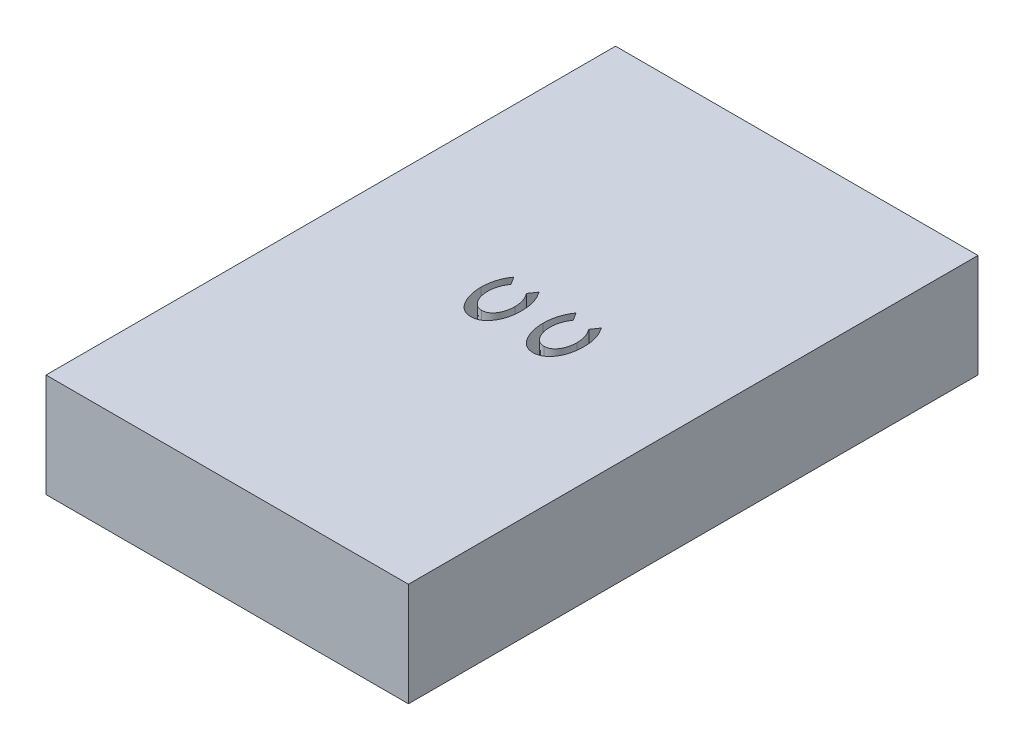
from build123d import *

# Parameters (mm, degrees)
SKETCH1_W           = 88.9
SKETCH1_H           = 139.7
BOSS_EXTRUDE1_DEPTH = 25.4
CUT_EXTRUDE1_DEPTH  = 168.52450567


with BuildPart() as part:
    # Sketch1 → Boss-Extrude1 (new body)
    with BuildSketch(Plane(origin=(0, 0, 0), x_dir=(1, 0, 0), z_dir=(0, 1, 0))):
        with Locations((44.45, 69.85)):
            Rectangle(SKETCH1_W, SKETCH1_H)
    extrude(amount=BOSS_EXTRUDE1_DEPTH)

    # Sketch2 → Cut-Extrude1 (cut, through all)
    with BuildSketch(Plane(origin=(0, 25.4, 0), x_dir=(1, 0, 0), z_dir=(0, 1, 0))):
        with BuildLine():
            Line((36.577373798, 78.153846154), (37.77563101, 76.274414062))
            add(Edge.make_bspline(
                [(37.77563101, 76.274414062), (37.664962214, 76.113861582), (37.445317785, 75.795212971), (37.162879914, 75.291703682), (36.925681736, 74.772328058), (36.730450301, 74.238357525), (36.577163714, 73.68982456), (36.468560921, 73.125780616), (36.40182813, 72.547061413), (36.394220943, 72.155741985), (36.390384615, 71.958398437)],
                knots=[0, 0, 0, 0, 1.014870556, 2.014214241, 3.001102769, 3.98480828, 4.971430097, 5.963129284, 6.972800063, 8, 8, 8, 8], degree=3))
            add(Edge.make_bspline(
                [(36.390384615, 71.958398437), (36.393377813, 71.792939644), (36.399248414, 71.468422954), (36.443557081, 70.991475949), (36.517968211, 70.534464254), (36.620523194, 70.09683415), (36.752274284, 69.678687906), (36.914168139, 69.280640221), (37.108484652, 68.903651895), (37.326823183, 68.548788057), (37.569716867, 68.227511987), (37.824226337, 67.941449173), (38.097834171, 67.702480559), (38.385102177, 67.50696409), (38.685378136, 67.350955263), (39.000978792, 67.242323381), (39.330352597, 67.174681108), (39.554883328, 67.167229511), (39.668419471, 67.163461538)],
                knots=[0, 0, 0, 0, 1.236321674, 2.424815318, 3.575766851, 4.69401689, 5.780795808, 6.848746087, 7.900938099, 8.946831598, 9.958236467, 10.907138323, 11.803145237, 12.665283653, 13.498535572, 14.323737613, 15.152381652, 16, 16, 16, 16], degree=3))
            add(Edge.make_bspline(
                [(39.668419471, 67.163461538), (39.748007513, 67.165250678), (39.90516447, 67.168783567), (40.136946178, 67.198178414), (40.362166206, 67.246351579), (40.580839023, 67.312433818), (40.793061158, 67.399091343), (40.99656681, 67.506603287), (41.194534534, 67.631357057), (41.385519673, 67.774696293), (41.567813467, 67.936339939), (41.73989101, 68.11496383), (41.903011866, 68.308346205), (42.054618736, 68.517975438), (42.197611899, 68.743098333), (42.327295574, 68.985111777), (42.451242707, 69.241404878), (42.559421543, 69.514041465), (42.662267999, 69.796836712), (42.745744244, 70.090882779), (42.822245264, 70.390597601), (42.879724408, 70.699372318), (42.928829975, 71.014763002), (42.95949701, 71.339107016), (42.982471369, 71.669951233), (42.98389709, 71.893482353), (42.984615385, 72.00609976)],
                knots=[0, 0, 0, 0, 0.878370325, 1.734456627, 2.574498608, 3.418521853, 4.252999509, 5.100956257, 5.956120674, 6.833789144, 7.734083648, 8.642771925, 9.569643021, 10.524649566, 11.496668884, 12.511490487, 13.55415472, 14.637651288, 15.74804586, 16.874551035, 18.0104046, 19.161605903, 20.34029342, 21.532889542, 22.757042949, 24, 24, 24, 24], degree=3))
            add(Edge.make_bspline(
                [(42.984615385, 72.00609976), (42.980936668, 72.19704111), (42.97372269, 72.571477934), (42.917534093, 73.120664236), (42.82534953, 73.644730676), (42.713236995, 74.065183128), (42.604306031, 74.394743398), (42.505596644, 74.645738433), (42.39334646, 74.903069597), (42.264922043, 75.166328639), (42.122153742, 75.436157063), (41.960136411, 75.709969559), (41.78835711, 75.992784045), (41.663072332, 76.17948337), (41.59936899, 76.274414062)],
                knots=[0, 0, 0, 0, 1.505133428, 2.95157324, 4.347295496, 5.696149315, 6.377987095, 7.082887976, 7.8216465, 8.590867715, 9.391685636, 10.227620631, 11.098801231, 12, 12, 12, 12], degree=3))
            Line((41.59936899, 76.274414062), (42.87585637, 78.096604567))
            add(Edge.make_bspline(
                [(42.87585637, 78.096604567), (42.958557236, 77.967270606), (43.12099867, 77.71323222), (43.349537759, 77.331274777), (43.554451699, 76.952528051), (43.745094918, 76.581070022), (43.912437349, 76.213394369), (44.059644341, 75.850814297), (44.190563887, 75.49513107), (44.299297026, 75.140499085), (44.394513924, 74.783639977), (44.473697575, 74.416630266), (44.542702334, 74.038110077), (44.597555402, 73.646547263), (44.64175971, 73.243814124), (44.671331567, 72.828177342), (44.691622294, 72.400633924), (44.693352667, 72.111067365), (44.694230769, 71.964122596)],
                knots=[0, 0, 0, 0, 1.133034675, 2.225512122, 3.28425737, 4.310857163, 5.306587224, 6.264611791, 7.198679476, 8.102922904, 9.001310792, 9.923925246, 10.873250138, 11.8405114, 12.841538757, 13.862963098, 14.915529496, 16, 16, 16, 16], degree=3))
            add(Edge.make_bspline(
                [(44.694230769, 71.964122596), (44.693192461, 71.82862974), (44.691134499, 71.560078482), (44.67289447, 71.162470184), (44.646980981, 70.773617497), (44.608717839, 70.394361154), (44.55975432, 70.024510238), (44.497438456, 69.664670639), (44.428648105, 69.313346757), (44.343309483, 68.97217754), (44.250487084, 68.638949929), (44.145317192, 68.31588636), (44.031774227, 68.001161721), (43.902201221, 67.698085675), (43.766497697, 67.402242905), (43.616383458, 67.116923464), (43.456257763, 66.840899007), (43.287659836, 66.573844881), (43.107980226, 66.321470347), (42.924748931, 66.081709076), (42.729540835, 65.863144829), (42.534429393, 65.655315388), (42.329698654, 65.466074428), (42.118010021, 65.295010291), (41.901222536, 65.138773706), (41.677641114, 65.000157305), (41.449445217, 64.874553401), (41.212605411, 64.771142633), (40.972595103, 64.677040611), (40.723563241, 64.606160005), (40.469441475, 64.548490671), (40.209532302, 64.506374354), (39.943064459, 64.48076868), (39.763243326, 64.478215331), (39.672235577, 64.476923077)],
                knots=[0, 0, 0, 0, 1.298272765, 2.573218945, 3.813355947, 5.032285749, 6.225204, 7.387463167, 8.531312365, 9.654715901, 10.756418465, 11.845370433, 12.909672022, 13.961228707, 15.002830252, 16.027824345, 17.049115466, 18.060171851, 19.052764301, 20.017055926, 20.949864095, 21.859426769, 22.747855794, 23.618782832, 24.466125739, 25.306602467, 26.13834979, 26.959512911, 27.781263853, 28.606712941, 29.437656039, 30.277292666, 31.128135197, 32, 32, 32, 32], degree=3))
            add(Edge.make_bspline(
                [(39.672235577, 64.476923077), (39.555076289, 64.479988857), (39.322481851, 64.486075301), (38.978776496, 64.530704397), (38.645116281, 64.604684079), (38.32262675, 64.711527402), (38.008865713, 64.844283467), (37.705838601, 65.009953171), (37.413706877, 65.205820603), (37.13071777, 65.42870573), (36.861870315, 65.682467706), (36.604216256, 65.96046838), (36.361713512, 66.265443656), (36.132393063, 66.595340938), (35.914282617, 66.950030279), (35.713090323, 67.332736564), (35.524138384, 67.739720189), (35.349496448, 68.169454533), (35.191800129, 68.616142314), (35.057286254, 69.075284069), (34.940048384, 69.541565605), (34.844031539, 70.017052023), (34.773155617, 70.501986243), (34.71837746, 70.994428955), (34.6883203, 71.49563776), (34.683300723, 71.832430887), (34.680769231, 72.002283654)],
                knots=[0, 0, 0, 0, 0.844847378, 1.677261827, 2.495243197, 3.306145251, 4.124113758, 4.949304973, 5.792818771, 6.658250146, 7.54425043, 8.456417024, 9.389892589, 10.351942713, 11.352673629, 12.391009715, 13.468471389, 14.587792652, 15.735379249, 16.883479151, 18.037210344, 19.202230831, 20.380353907, 21.570808104, 22.774900877, 24, 24, 24, 24], degree=3))
            add(Edge.make_bspline(
                [(34.680769231, 72.002283654), (34.682194083, 72.147328621), (34.68502682, 72.435691444), (34.709119235, 72.866514957), (34.745943632, 73.293144145), (34.8027808, 73.715412343), (34.870840848, 74.133702206), (34.954239312, 74.548371766), (35.05675489, 74.958239197), (35.169540814, 75.363692059), (35.299316105, 75.759476537), (35.442283746, 76.143411457), (35.598676538, 76.514036203), (35.7685538, 76.870270397), (35.949255579, 77.212963054), (36.145571778, 77.539968331), (36.351573511, 77.855469884), (36.502433018, 78.054818156), (36.577373798, 78.153846154)],
                knots=[0, 0, 0, 0, 1.062783603, 2.112912184, 3.161042814, 4.199868571, 5.234241515, 6.266175642, 7.298204485, 8.329549066, 9.349446558, 10.349319441, 11.330929369, 12.296138, 13.240599753, 14.168577121, 15.090224669, 16, 16, 16, 16], degree=3))
        make_face()
        with BuildLine():
            Line((51.841796875, 78.153846154), (53.040054087, 76.274414062))
            add(Edge.make_bspline(
                [(53.040054087, 76.274414062), (52.929385291, 76.113861582), (52.709740862, 75.795212971), (52.42730299, 75.291703682), (52.190104813, 74.772328058), (51.994873377, 74.238357525), (51.841586791, 73.68982456), (51.732983998, 73.125780616), (51.666251207, 72.547061413), (51.65864402, 72.155741985), (51.654807692, 71.958398437)],
                knots=[0, 0, 0, 0, 1.014870556, 2.014214241, 3.001102769, 3.98480828, 4.971430097, 5.963129284, 6.972800063, 8, 8, 8, 8], degree=3))
            add(Edge.make_bspline(
                [(51.654807692, 71.958398437), (51.65780089, 71.792939644), (51.663671491, 71.468422954), (51.707980158, 70.991475949), (51.782391288, 70.534464254), (51.884946271, 70.09683415), (52.01669736, 69.678687906), (52.178591216, 69.280640221), (52.372907729, 68.903651895), (52.59124626, 68.548788057), (52.834139944, 68.227511987), (53.088649414, 67.941449173), (53.362257248, 67.702480559), (53.649525254, 67.50696409), (53.949801213, 67.350955263), (54.265401869, 67.242323381), (54.594775674, 67.174681108), (54.819306405, 67.167229511), (54.932842548, 67.163461538)],
                knots=[0, 0, 0, 0, 1.236321674, 2.424815318, 3.575766851, 4.69401689, 5.780795808, 6.848746087, 7.900938099, 8.946831598, 9.958236467, 10.907138323, 11.803145237, 12.665283653, 13.498535572, 14.323737613, 15.152381652, 16, 16, 16, 16], degree=3))
            add(Edge.make_bspline(
                [(54.932842548, 67.163461538), (55.01243059, 67.165250678), (55.169587547, 67.168783567), (55.401369255, 67.198178414), (55.626589283, 67.246351579), (55.8452621, 67.312433818), (56.057484235, 67.399091343), (56.260989887, 67.506603287), (56.458957611, 67.631357057), (56.64994275, 67.774696293), (56.832236544, 67.936339939), (57.004314087, 68.11496383), (57.167434943, 68.308346205), (57.319041813, 68.517975438), (57.462034976, 68.743098333), (57.591718651, 68.985111777), (57.715665784, 69.241404878), (57.82384462, 69.514041465), (57.926691076, 69.796836712), (58.010167321, 70.090882779), (58.086668341, 70.390597601), (58.144147485, 70.699372318), (58.193253052, 71.014763002), (58.223920087, 71.339107016), (58.246894446, 71.669951233), (58.248320167, 71.893482353), (58.249038462, 72.00609976)],
                knots=[0, 0, 0, 0, 0.878370325, 1.734456627, 2.574498608, 3.418521853, 4.252999509, 5.100956257, 5.956120674, 6.833789144, 7.734083648, 8.642771925, 9.569643021, 10.524649566, 11.496668884, 12.511490487, 13.55415472, 14.637651288, 15.74804586, 16.874551035, 18.0104046, 19.161605903, 20.34029342, 21.532889542, 22.757042949, 24, 24, 24, 24], degree=3))
            add(Edge.make_bspline(
                [(58.249038462, 72.00609976), (58.245359745, 72.19704111), (58.238145767, 72.571477934), (58.18195717, 73.120664236), (58.089772607, 73.644730676), (57.977660072, 74.065183128), (57.868729108, 74.394743398), (57.770019721, 74.645738433), (57.657769537, 74.903069597), (57.529345119, 75.166328639), (57.386576819, 75.436157063), (57.224559487, 75.709969559), (57.052780187, 75.992784045), (56.927495409, 76.17948337), (56.863792067, 76.274414062)],
                knots=[0, 0, 0, 0, 1.505133428, 2.95157324, 4.347295496, 5.696149315, 6.377987095, 7.082887976, 7.8216465, 8.590867715, 9.391685636, 10.227620631, 11.098801231, 12, 12, 12, 12], degree=3))
            Line((56.863792067, 76.274414062), (58.140279447, 78.096604567))
            add(Edge.make_bspline(
                [(58.140279447, 78.096604567), (58.222980312, 77.967270606), (58.385421747, 77.71323222), (58.613960835, 77.331274777), (58.818874776, 76.952528051), (59.009517995, 76.581070022), (59.176860426, 76.213394369), (59.324067418, 75.850814297), (59.454986964, 75.49513107), (59.563720103, 75.140499085), (59.658937001, 74.783639977), (59.738120652, 74.416630266), (59.807125411, 74.038110077), (59.861978479, 73.646547263), (59.906182787, 73.243814124), (59.935754644, 72.828177342), (59.956045371, 72.400633924), (59.957775744, 72.111067365), (59.958653846, 71.964122596)],
                knots=[0, 0, 0, 0, 1.133034675, 2.225512122, 3.28425737, 4.310857163, 5.306587224, 6.264611791, 7.198679476, 8.102922904, 9.001310792, 9.923925246, 10.873250138, 11.8405114, 12.841538757, 13.862963098, 14.915529496, 16, 16, 16, 16], degree=3))
            add(Edge.make_bspline(
                [(59.958653846, 71.964122596), (59.957615538, 71.82862974), (59.955557576, 71.560078482), (59.937317547, 71.162470184), (59.911404058, 70.773617497), (59.873140916, 70.394361154), (59.824177397, 70.024510238), (59.761861533, 69.664670639), (59.693071181, 69.313346757), (59.60773256, 68.97217754), (59.51491016, 68.638949929), (59.409740269, 68.31588636), (59.296197304, 68.001161721), (59.166624298, 67.698085675), (59.030920774, 67.402242905), (58.880806535, 67.116923464), (58.72068084, 66.840899007), (58.552082913, 66.573844881), (58.372403303, 66.321470347), (58.189172007, 66.081709076), (57.993963912, 65.863144829), (57.79885247, 65.655315388), (57.594121731, 65.466074428), (57.382433098, 65.295010291), (57.165645613, 65.138773706), (56.942064191, 65.000157305), (56.713868293, 64.874553401), (56.477028487, 64.771142633), (56.23701818, 64.677040611), (55.987986318, 64.606160005), (55.733864552, 64.548490671), (55.473955378, 64.506374354), (55.207487536, 64.48076868), (55.027666403, 64.478215331), (54.936658654, 64.476923077)],
                knots=[0, 0, 0, 0, 1.298272765, 2.573218945, 3.813355947, 5.032285749, 6.225204, 7.387463167, 8.531312365, 9.654715901, 10.756418465, 11.845370433, 12.909672022, 13.961228707, 15.002830252, 16.027824345, 17.049115466, 18.060171851, 19.052764301, 20.017055926, 20.949864095, 21.859426769, 22.747855794, 23.618782832, 24.466125739, 25.306602467, 26.13834979, 26.959512911, 27.781263853, 28.606712941, 29.437656039, 30.277292666, 31.128135197, 32, 32, 32, 32], degree=3))
            add(Edge.make_bspline(
                [(54.936658654, 64.476923077), (54.819499366, 64.479988857), (54.586904928, 64.486075301), (54.243199573, 64.530704397), (53.909539358, 64.604684079), (53.587049827, 64.711527402), (53.27328879, 64.844283467), (52.970261677, 65.009953171), (52.678129954, 65.205820603), (52.395140847, 65.42870573), (52.126293392, 65.682467706), (51.868639333, 65.96046838), (51.626136589, 66.265443656), (51.39681614, 66.595340938), (51.178705694, 66.950030279), (50.9775134, 67.332736564), (50.788561461, 67.739720189), (50.613919525, 68.169454533), (50.456223206, 68.616142314), (50.321709331, 69.075284069), (50.20447146, 69.541565605), (50.108454616, 70.017052023), (50.037578694, 70.501986243), (49.982800537, 70.994428955), (49.952743377, 71.49563776), (49.9477238, 71.832430887), (49.945192308, 72.002283654)],
                knots=[0, 0, 0, 0, 0.844847378, 1.677261827, 2.495243197, 3.306145251, 4.124113758, 4.949304973, 5.792818771, 6.658250146, 7.54425043, 8.456417024, 9.389892589, 10.351942713, 11.352673629, 12.391009715, 13.468471389, 14.587792652, 15.735379249, 16.883479151, 18.037210344, 19.202230831, 20.380353907, 21.570808104, 22.774900877, 24, 24, 24, 24], degree=3))
            add(Edge.make_bspline(
                [(49.945192308, 72.002283654), (49.94661716, 72.147328621), (49.949449897, 72.435691444), (49.973542312, 72.866514957), (50.010366709, 73.293144145), (50.067203877, 73.715412343), (50.135263925, 74.133702206), (50.218662389, 74.548371766), (50.321177967, 74.958239197), (50.433963891, 75.363692059), (50.563739182, 75.759476537), (50.706706823, 76.143411457), (50.863099615, 76.514036203), (51.032976877, 76.870270397), (51.213678656, 77.212963054), (51.409994855, 77.539968331), (51.615996588, 77.855469884), (51.766856095, 78.054818156), (51.841796875, 78.153846154)],
                knots=[0, 0, 0, 0, 1.062783603, 2.112912184, 3.161042814, 4.199868571, 5.234241515, 6.266175642, 7.298204485, 8.329549066, 9.349446558, 10.349319441, 11.330929369, 12.296138, 13.240599753, 14.168577121, 15.090224669, 16, 16, 16, 16], degree=3))
        make_face()
    extrude(amount=-CUT_EXTRUDE1_DEPTH, mode=Mode.SUBTRACT)


solid = part.part
